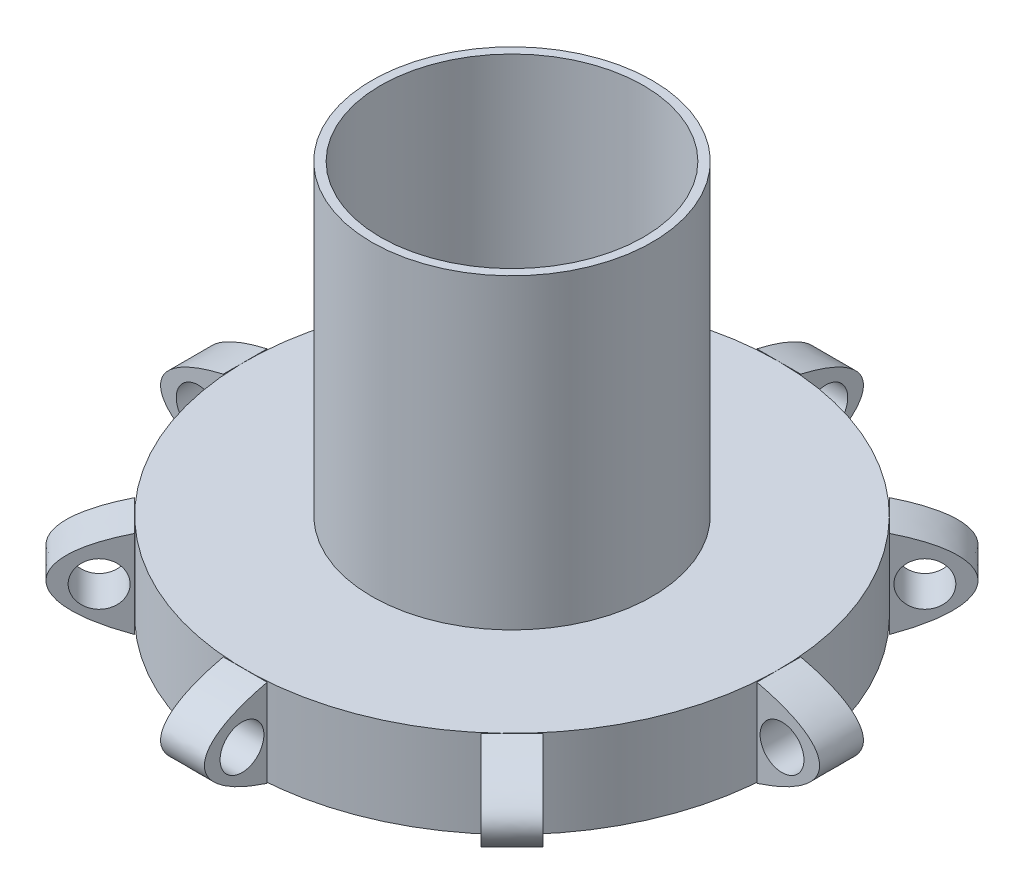
from build123d import *

# Parameters (mm, degrees)
SKETCH2_R           = 15
CUT_EXTRUDE1_DEPTH  = 50
BOSS_EXTRUDE1_DEPTH = 2.5
SKETCH5_R           = 2.5
CUT_EXTRUDE2_DEPTH  = 57.393394828
CIRPATTERN1_COUNT   = 8


with BuildPart() as part:
    # Sketch1 → Revolve1 (revolve)
    with BuildSketch(Plane.XY, mode=Mode.PRIVATE) as revolve1_sk:
        with BuildLine():
            Line((0, 0), (0, 23.893433396))
            Line((0, 23.893433396), (16, 23.893433396))
            Line((16, 23.893433396), (16, -11.106566604))
            Line((16, -11.106566604), (30.441623821, -11.106566604))
            Line((30.441623821, -11.106566604), (30.441623821, -21.106566604))
            Line((30.441623821, -21.106566604), (16, -21.106566604))
            Line((16, -21.106566604), (17.835503323, -24.646224725))
            ThreePointArc((17.835503323, -24.646224725), (17.80226201, -25.626017334), (16.947761607, -26.106566604))
            Line((16.947761607, -26.106566604), (16, -26.106566604))
            Line((16, -26.106566604), (0, -26.106566604))
            Line((0, -26.106566604), (0, 0))
        make_face()
    revolve(revolve1_sk.sketch.rotate(Axis((0, 0, 0), (0, 1, 0)), 90), axis=Axis((0, 0, 0), (0, 1, 0)))

    # Sketch2 → Cut-Extrude1 (cut)
    with BuildSketch(Plane(origin=(0, 23.893433396, 0), x_dir=(1, 0, 0), z_dir=(0, 1, 0))):
        with Locations(Location((0, 0, 0), (0, 0, 270))):
            Circle(SKETCH2_R)
    extrude(amount=-CUT_EXTRUDE1_DEPTH, mode=Mode.SUBTRACT)


with BuildPart() as body_2:
    # Sketch4 → Boss-Extrude1 (new, symmetric)
    with BuildSketch(Plane(origin=(0, 0, 0), x_dir=(0, -1, 0), z_dir=(0, 0, 1))):
        with BuildLine():
            Line((11.106566604, 30.441623821), (21.106566604, 30.441623821))
            add(Edge.make_bspline(
                [(11.106566604, 30.441623821), (13.279712343, 39.86416546), (17.962889864, 40.098555652), (21.106566604, 30.441623821)],
                knots=[0, 0, 0, 0, 1, 1, 1, 1], degree=3))
        make_face()
    extrude(amount=BOSS_EXTRUDE1_DEPTH, both=True)

    # Sketch5 → Cut-Extrude2 (cut, through all)
    with BuildSketch(Plane(origin=(0, 0, -2.5), x_dir=(-1, 0, 0), z_dir=(0, 0, -1))):
        with Locations((-33.309057024, -16.106566604)):
            Circle(SKETCH5_R)
    extrude(amount=-CUT_EXTRUDE2_DEPTH, mode=Mode.SUBTRACT)


with BuildPart() as cirpattern1_1:
    # CirPattern1: pattern copy
    add(body_2.part.rotate(Axis((0, -11.106566604, 0), (0, -1, 0)), 1 * 360 / CIRPATTERN1_COUNT))


with BuildPart() as cirpattern1_2:
    # CirPattern1: pattern copy
    add(body_2.part.rotate(Axis((0, -11.106566604, 0), (0, -1, 0)), 2 * 360 / CIRPATTERN1_COUNT))


with BuildPart() as cirpattern1_3:
    # CirPattern1: pattern copy
    add(body_2.part.rotate(Axis((0, -11.106566604, 0), (0, -1, 0)), 3 * 360 / CIRPATTERN1_COUNT))


with BuildPart() as cirpattern1_4:
    # CirPattern1: pattern copy
    add(body_2.part.rotate(Axis((0, -11.106566604, 0), (0, -1, 0)), 4 * 360 / CIRPATTERN1_COUNT))


with BuildPart() as cirpattern1_5:
    # CirPattern1: pattern copy
    add(body_2.part.rotate(Axis((0, -11.106566604, 0), (0, -1, 0)), 5 * 360 / CIRPATTERN1_COUNT))


with BuildPart() as cirpattern1_6:
    # CirPattern1: pattern copy
    add(body_2.part.rotate(Axis((0, -11.106566604, 0), (0, -1, 0)), 6 * 360 / CIRPATTERN1_COUNT))


with BuildPart() as cirpattern1_7:
    # CirPattern1: pattern copy
    add(body_2.part.rotate(Axis((0, -11.106566604, 0), (0, -1, 0)), 7 * 360 / CIRPATTERN1_COUNT))


solid = Compound([part.part, body_2.part, cirpattern1_1.part, cirpattern1_2.part, cirpattern1_3.part, cirpattern1_4.part, cirpattern1_5.part, cirpattern1_6.part, cirpattern1_7.part])
